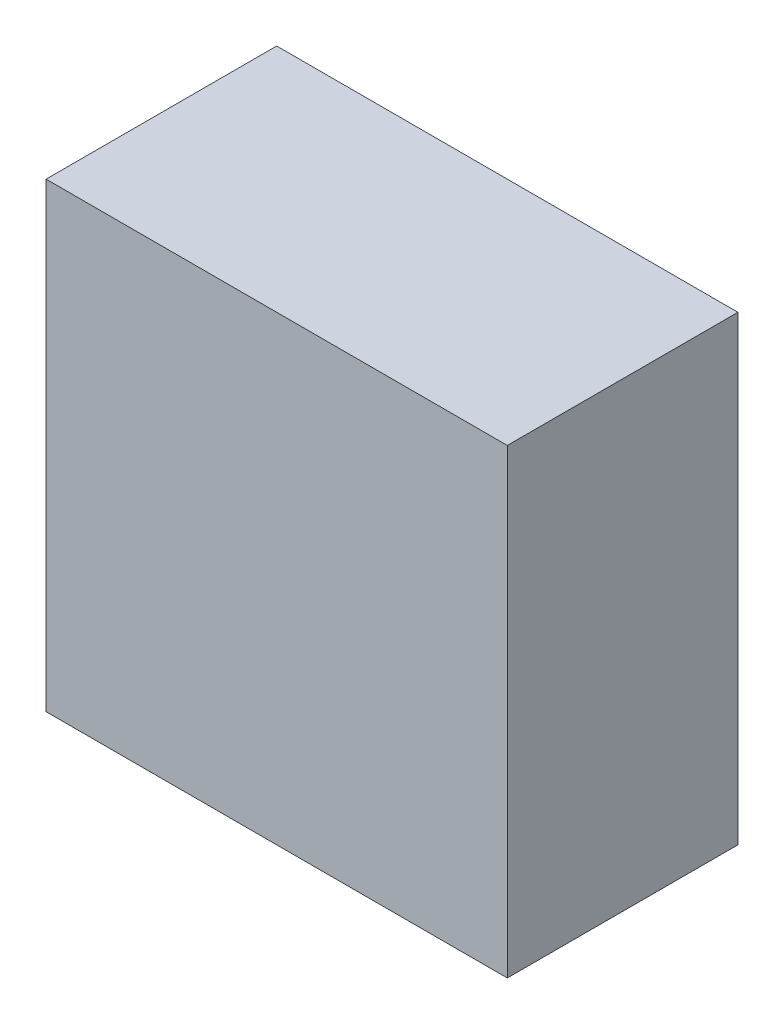
from build123d import *

# Parameters (mm, degrees)
SKETCH1_W           = 10
SKETCH1_H           = 5
BOSS_EXTRUDE1_DEPTH = 10


with BuildPart() as part:
    # Sketch1 → Boss-Extrude1 (new body)
    with BuildSketch(Plane(origin=(0, 0, 0), x_dir=(1, 0, 0), z_dir=(0, 1, 0))):
        Rectangle(SKETCH1_W, SKETCH1_H)
    extrude(amount=BOSS_EXTRUDE1_DEPTH)


solid = part.part
